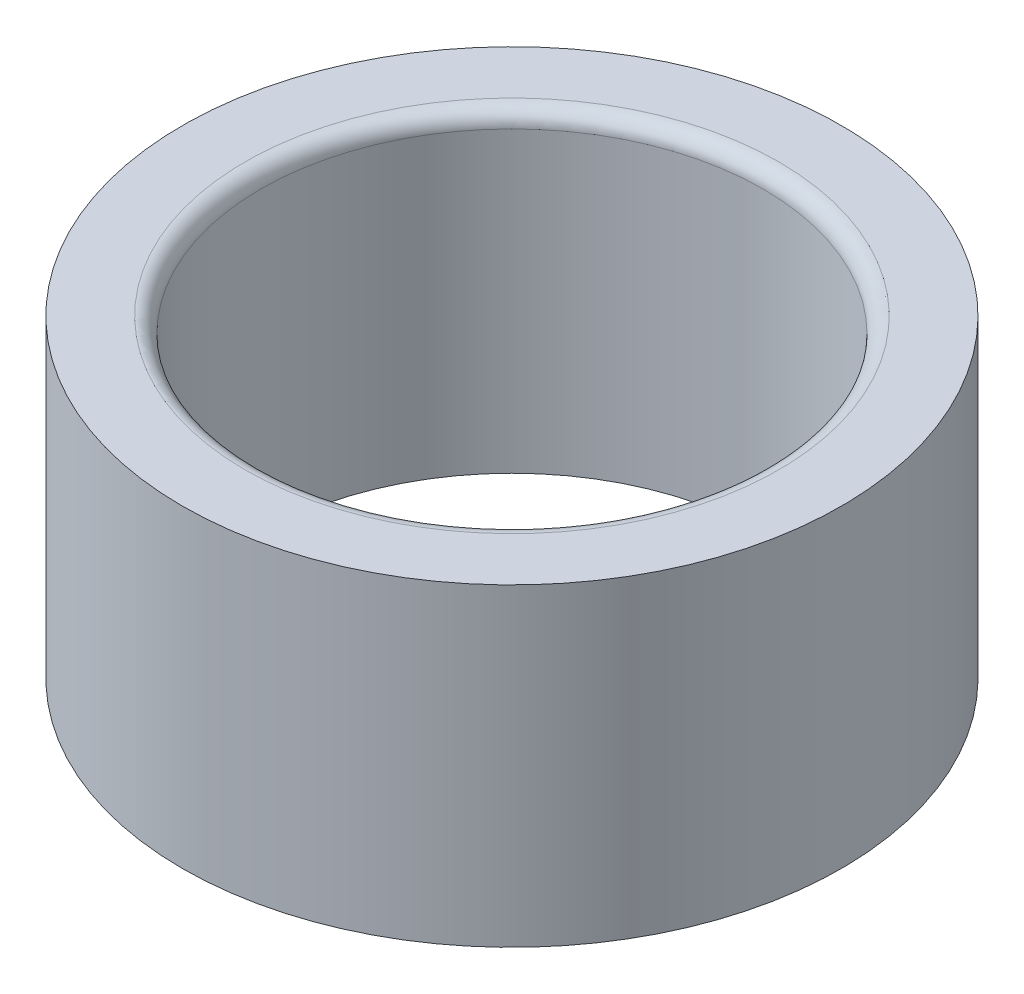
from build123d import *

# Parameters (mm, degrees)
SKETCH1_R           = 21
SKETCH1_R_2         = 16
BOSS_EXTRUDE1_DEPTH = 20
FILLET1_R           = 1


with BuildPart() as part:
    # Sketch1 → Boss-Extrude1 (new body)
    with BuildSketch(Plane(origin=(0, 0, 0), x_dir=(1, 0, 0), z_dir=(0, 1, 0))):
        with Locations(Location((0, 0, 0), (0, 0, 270))):
            Circle(SKETCH1_R)
        with Locations(Location((0, 0, 0), (0, 0, 270))):
            Circle(SKETCH1_R_2, mode=Mode.SUBTRACT)
    extrude(amount=BOSS_EXTRUDE1_DEPTH)

    # Fillet1
    fillet1_edges = [part.edges().sort_by_distance(p)[0] for p in [
        (0, 20, -16),
    ]]
    fillet(fillet1_edges, radius=FILLET1_R)


solid = part.part
